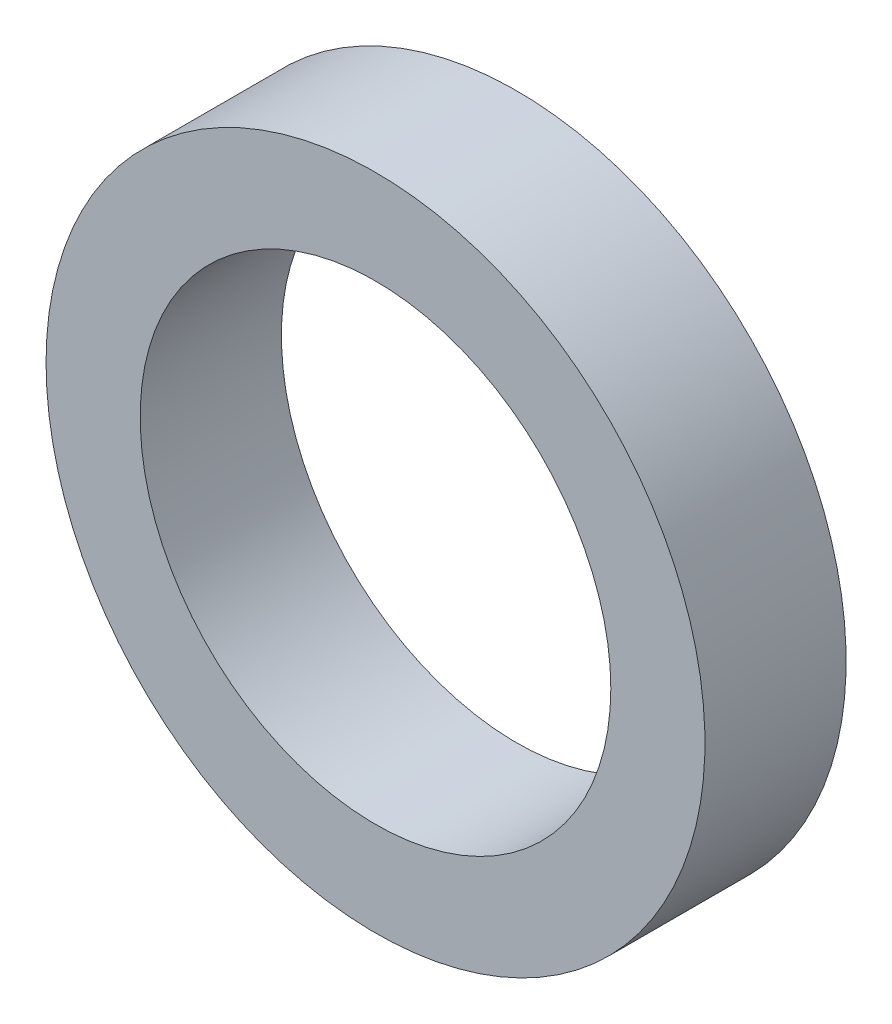
from build123d import *

# Parameters (mm, degrees)
SKETCH1_R          = 11.1125
SKETCH1_R_2        = 6.35
EXTRUDE1_DEPTH     = 2.38125
SKETCH5_R          = 7.9375
CUT_EXTRUDE1_DEPTH = 17.421227687


with BuildPart() as part:
    # Sketch1 → Extrude1 (new, symmetric)
    with BuildSketch(Plane.XY):
        with Locations(Location((0, 0, 0), (0, 0, 180))):
            Circle(SKETCH1_R)
        with Locations(Location((0, 0, 0), (0, 0, 180))):
            Circle(SKETCH1_R_2, mode=Mode.SUBTRACT)
    extrude(amount=EXTRUDE1_DEPTH, both=True)

    # Sketch5 → Cut-Extrude1 (cut, through all)
    with BuildSketch(Plane.XY.offset(2.38125)):
        Circle(SKETCH5_R)
    extrude(amount=-CUT_EXTRUDE1_DEPTH, mode=Mode.SUBTRACT)


solid = part.part
